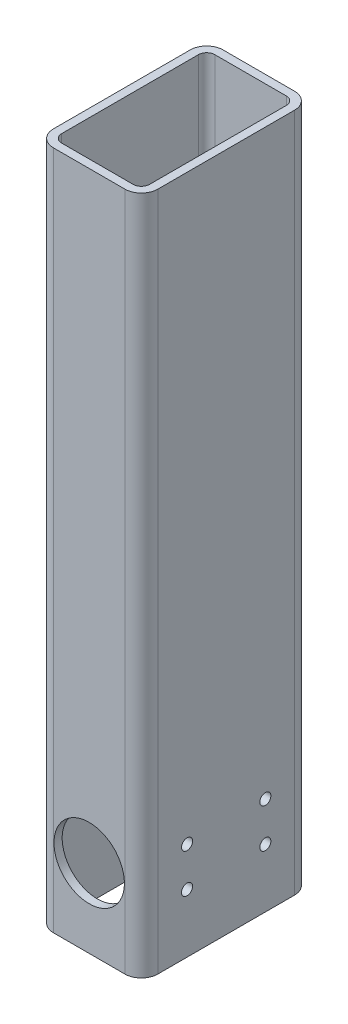
from build123d import *

# Parameters (mm, degrees)
AUFSATZ_LINEAR_AUSTRAGEN1_DEPTH      = 461
AUFSATZ_LINEAR_AUSTRAGEN1_DEPTH_BACK = 60
SCHNITT_LINEAR_AUSTRAGEN1_DEPTH      = 468.275079584
SCHNITT_LINEAR_AUSTRAGEN1_DEPTH_BACK = 468.275079584
SKIZZE3_R                            = 27
LINEARES_MUSTER2_COUNT               = 2
LINEARES_MUSTER2_PITCH               = 60
LINEARES_MUSTER2_COUNT_DIR2          = 2
LINEARES_MUSTER2_PITCH_DIR2          = 30


with BuildPart() as part:
    # Skizze1 → Aufsatz-Linear austragen1 (new, two sides: drawn at the far end of the back side and taken through both)
    with BuildSketch(Plane(origin=(0, 0, 0), x_dir=(1, 0, 0), z_dir=(0, 1, 0)).offset(-AUFSATZ_LINEAR_AUSTRAGEN1_DEPTH_BACK)):
        with BuildLine():
            Line((-27.4, -65), (27.4, -65))
            ThreePointArc((27.4, -65), (36.309545443, -61.309545443), (40, -52.4))
            Line((40, -52.4), (40, 52.4))
            ThreePointArc((40, 52.4), (36.309545443, 61.309545443), (27.4, 65))
            Line((27.4, 65), (-27.4, 65))
            ThreePointArc((-27.4, 65), (-36.309545443, 61.309545443), (-40, 52.4))
            Line((-40, 52.4), (-40, -52.4))
            ThreePointArc((-40, -52.4), (-36.309545443, -61.309545443), (-27.4, -65))
        make_face()
        with BuildLine():
            Line((-27.4, -58.7), (27.4, -58.7))
            ThreePointArc((27.4, -58.7), (31.854772721, -56.854772721), (33.7, -52.4))
            Line((33.7, -52.4), (33.7, 52.4))
            ThreePointArc((33.7, 52.4), (31.854772721, 56.854772721), (27.4, 58.7))
            Line((27.4, 58.7), (-27.4, 58.7))
            ThreePointArc((-27.4, 58.7), (-31.854772721, 56.854772721), (-33.7, 52.4))
            Line((-33.7, 52.4), (-33.7, -52.4))
            ThreePointArc((-33.7, -52.4), (-31.854772721, -56.854772721), (-27.4, -58.7))
        make_face(mode=Mode.SUBTRACT)
    extrude(amount=AUFSATZ_LINEAR_AUSTRAGEN1_DEPTH + AUFSATZ_LINEAR_AUSTRAGEN1_DEPTH_BACK)

    # Skizze3 → Schnitt-Linear austragen1 (cut, two sides: drawn at the far end of the back side and taken through both)
    with BuildSketch(Plane.XY.offset(-SCHNITT_LINEAR_AUSTRAGEN1_DEPTH_BACK)):
        Circle(SKIZZE3_R)
    extrude(amount=SCHNITT_LINEAR_AUSTRAGEN1_DEPTH + SCHNITT_LINEAR_AUSTRAGEN1_DEPTH_BACK, mode=Mode.SUBTRACT)

    # Skizze7 → M10 Gewindebohrung2 (revolve, cut)
    with BuildSketch(Plane(origin=(40, -15, 30), x_dir=(0, 0, -1), z_dir=(0, 1, 0))):
        Polygon((0, 0), (0, 30.053657631), (4.25, 27.5), (4.25, 0), align=None)
    m10_gewindebohrung2 = revolve(axis=Axis((46.35, -15, 30), (-1, 0, 0)), mode=Mode.SUBTRACT)

    # Lineares Muster2: M10 Gewindebohrung2 2 × 2
    with Locations(*[(0, j * LINEARES_MUSTER2_PITCH_DIR2, -i * LINEARES_MUSTER2_PITCH) for i in range(LINEARES_MUSTER2_COUNT) for j in range(LINEARES_MUSTER2_COUNT_DIR2) if (i, j) != (0, 0)]):
        add(m10_gewindebohrung2, mode=Mode.SUBTRACT)


solid = part.part
